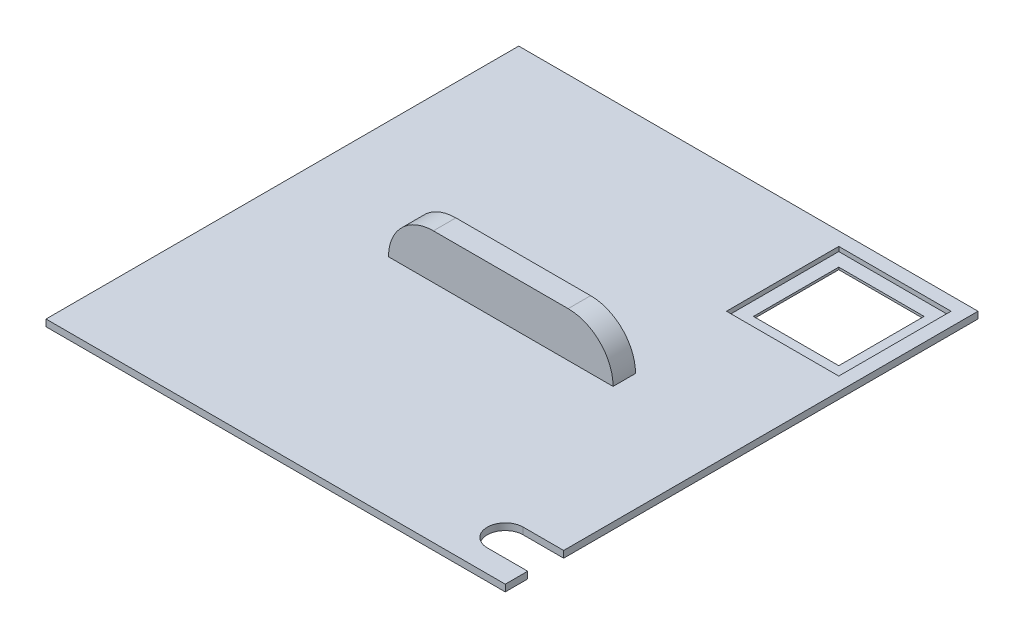
from build123d import *

# Parameters (mm, degrees)
BOSS_EXTRUDE1_DEPTH = 1.5
SKETCH2_W           = 30
SKETCH2_H           = 5
BOSS_EXTRUDE2_DEPTH = 10
SKETCH3_W           = 10
SKETCH3_H           = 5
REVOLVE_THIN1_ANGLE = 180
SKETCH5_W           = 25
SKETCH5_H           = 25
CUT_EXTRUDE1_DEPTH  = 1
SKETCH6_W           = 19
SKETCH6_H           = 19
CUT_EXTRUDE2_DEPTH  = 3


with BuildPart() as part:
    # Sketch1 → Boss-Extrude1 (new body)
    with BuildSketch(Plane(origin=(0, 0, 0), x_dir=(1, 0, 0), z_dir=(0, 1, 0))):
        with BuildLine():
            ThreePointArc((42.125, -47.625), (38.125, -43.625), (42.125, -39.625))
            Line((42.125, -39.625), (51.125, -39.625))
            Line((51.125, -39.625), (51.125, 52.625))
            Line((51.125, 52.625), (-51.125, 52.625))
            Line((-51.125, 52.625), (-51.125, -52.625))
            Line((-51.125, -52.625), (51.125, -52.625))
            Line((51.125, -52.625), (51.125, -47.625))
            Line((51.125, -47.625), (42.125, -47.625))
        make_face()
    extrude(amount=BOSS_EXTRUDE1_DEPTH)

    # Sketch2 → Boss-Extrude2 (add)
    with BuildSketch(Plane(origin=(0, 1.5, 0), x_dir=(1, 0, 0), z_dir=(0, 1, 0))):
        Rectangle(SKETCH2_W, SKETCH2_H)
    extrude(amount=BOSS_EXTRUDE2_DEPTH)

    # Sketch3 → Revolve-Thin1 (revolve)
    with BuildSketch(Plane(origin=(0, 1.5, 0), x_dir=(1, 0, 0), z_dir=(0, 1, 0))):
        with Locations((-20, 0)):
            Rectangle(SKETCH3_W, SKETCH3_H)
    revolve_thin1 = revolve(axis=Axis((-15, 1.5, 2.5), (0, 0, -1)), revolution_arc=REVOLVE_THIN1_ANGLE)

    # Mirror1: Revolve-Thin1 across plane
    add(revolve_thin1.mirror(Plane(origin=(0, 0, 0), x_dir=(0, 0, 1), z_dir=(1, 0, 0))))

    # Sketch5 → Cut-Extrude1 (cut)
    with BuildSketch(Plane(origin=(0, 1.5, 0), x_dir=(1, 0, 0), z_dir=(0, 1, 0))):
        with Locations((35.625, 37.125)):
            Rectangle(SKETCH5_W, SKETCH5_H)
    extrude(amount=-CUT_EXTRUDE1_DEPTH, mode=Mode.SUBTRACT)

    # Sketch6 → Cut-Extrude2 (cut)
    with BuildSketch(Plane(origin=(0, 0.5, 0), x_dir=(1, 0, 0), z_dir=(0, 1, 0))):
        with Locations((35.625, 37.125)):
            Rectangle(SKETCH6_W, SKETCH6_H)
    extrude(amount=-CUT_EXTRUDE2_DEPTH, mode=Mode.SUBTRACT)


solid = part.part
